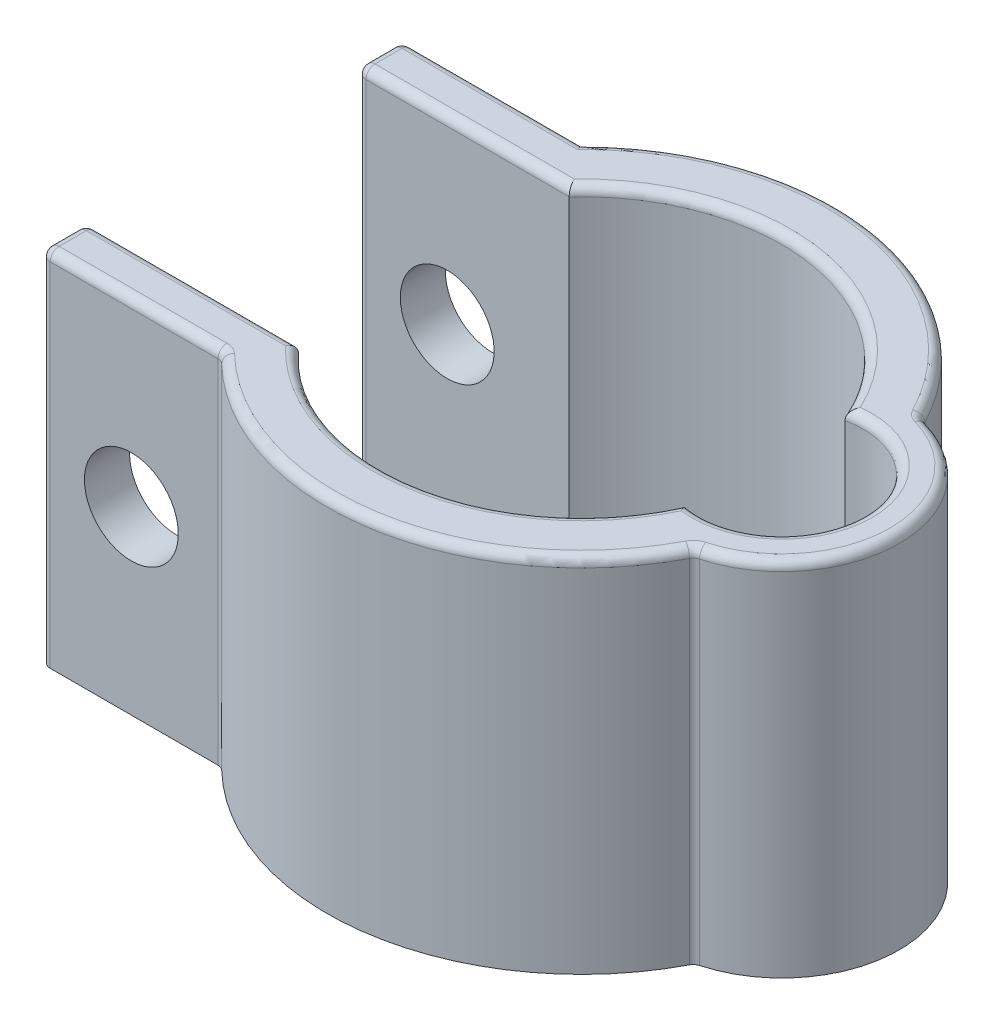
from build123d import *

# Parameters (mm, degrees)
BOSS_EXTRU_1_DEPTH      = 20
ESQUISSE2_R             = 2.6
ENL_V_MAT_EXTRU_1_DEPTH = 38.127165776
CONG_2_R                = 0.5


with BuildPart() as part:
    # Esquisse1 → Boss.-Extru.1 (new body)
    with BuildSketch(Plane(origin=(0, 0, 0), x_dir=(1, 0, 0), z_dir=(0, 1, 0))):
        with BuildLine():
            Line((-8.182909018, 7.5), (-19.940321926, 7.5))
            Line((-19.940321926, 7.5), (-19.940321926, 10))
            Line((-19.940321926, 10), (-9.940321926, 10))
            ThreePointArc((-9.940321926, 10), (2.269289353, 13.916189343), (12.602252252, 6.324020728))
            ThreePointArc((12.602252252, 6.324020728), (17.6, 0), (12.602252252, -6.324020728))
            ThreePointArc((12.602252252, -6.324020728), (2.269289353, -13.916189343), (-9.940321926, -10))
            Line((-9.940321926, -10), (-19.940321926, -10))
            Line((-19.940321926, -10), (-19.940321926, -7.5))
            Line((-19.940321926, -7.5), (-8.182909018, -7.5))
            ThreePointArc((-8.182909018, -7.5), (1.843161538, -10.945901313), (10.187837838, -4.406581463))
            ThreePointArc((10.187837838, -4.406581463), (15.6, 0), (10.187837838, 4.406581463))
            ThreePointArc((10.187837838, 4.406581463), (1.843161538, 10.945901313), (-8.182909018, 7.5))
        make_face()
    extrude(amount=BOSS_EXTRU_1_DEPTH)

    # Esquisse2 → Enlèv. mat.-Extru.1 (cut, through all)
    with BuildSketch(Plane(origin=(0, 0, -10), x_dir=(-1, 0, 0), z_dir=(0, 0, -1))):
        with Locations((14.940321926, 10)):
            Circle(ESQUISSE2_R)
    extrude(amount=-ENL_V_MAT_EXTRU_1_DEPTH, mode=Mode.SUBTRACT)

    # Congé2
    cong_2_edges = [part.edges().sort_by_distance(p)[0] for p in [
        (-19.940321926, 20, -8.75),
        (-14.061615472, 20, -7.5),
        (12.602252252, 10, -6.324020728),
        (12.602252252, 10, 6.324020728),
        (-9.940321926, 10, 10),
        (1.843161538, 20, -10.945901313),
        (-19.940321926, 10, 10),
        (-19.940321926, 10, 7.5),
        (-19.940321926, 10, -7.5),
        (-19.940321926, 10, -10),
        (15.6, 20, 0),
        (1.843161538, 20, 10.945901313),
        (-14.061615472, 20, 7.5),
        (-19.940321926, 20, 8.75),
        (-14.940321926, 20, 10),
        (2.269289353, 20, 13.916189343),
        (17.6, 20, 0),
        (2.269289353, 20, -13.916189343),
        (-14.940321926, 20, -10),
    ]]
    fillet(cong_2_edges, radius=CONG_2_R)


solid = part.part
